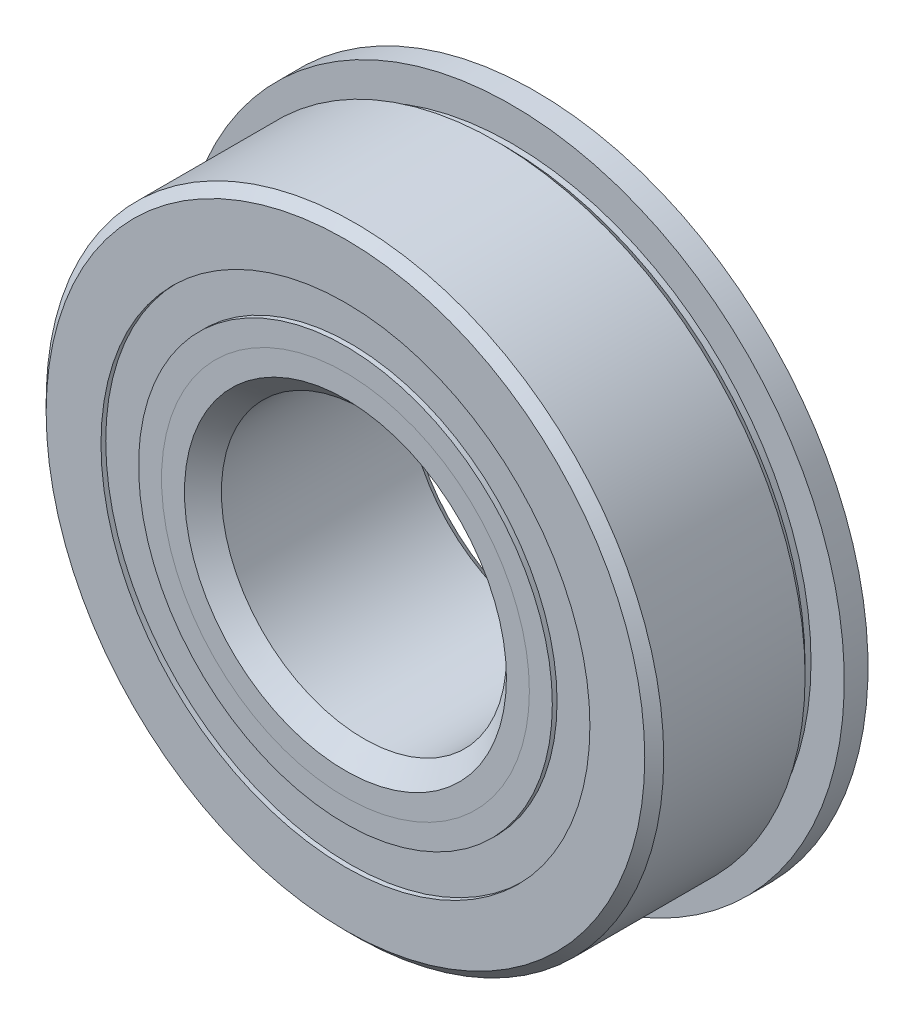
from build123d import *

# Parameters (mm, degrees)
SKETCH5_W         = 1.5875
SKETCH5_H         = 4.055103022
CIRPATTERN1_COUNT = 14
SKETCH7_W         = 2.943392574
SKETCH7_H         = 2.512087912


with BuildPart() as part:
    # Sketch1 → Revolve1 (revolve)
    with BuildSketch(Plane(origin=(0, 0, 0), x_dir=(0, 0, -1), z_dir=(1, 0, 0))):
        with BuildLine():
            Line((5.715, 20.6375), (-5.715, 20.6375))
            Line((-5.715, 20.6375), (-6.35, 20.0025))
            Line((-6.35, 20.0025), (-6.35, 16.337293956))
            Line((-6.35, 16.337293956), (-2.822222222, 16.337293956))
            ThreePointArc((-2.822222222, 16.337293956), (0, 18.170357426), (2.822222222, 16.337293956))
            Line((2.822222222, 16.337293956), (6.35, 16.337293956))
            Line((6.35, 16.337293956), (6.35, 20.0025))
            Line((6.35, 20.0025), (5.715, 20.6375))
        make_face()
    revolve(axis=Axis((0, 0, 6.35), (0, 0, -1)))

    # Sketch5 → Revolve5 (revolve)
    with BuildSketch(Plane(origin=(0, 0, 0), x_dir=(0, 0, -1), z_dir=(1, 0, 0))):
        with Locations((5.55625, 20.197448489)):
            Rectangle(SKETCH5_W, SKETCH5_H)
    revolve(axis=Axis((0, 0, -7.9375), (0, 0, 1)))

    # Sketch6 → Cut-Revolve1 (revolve, cut)
    with BuildSketch(Plane(origin=(0, 0, 0), x_dir=(0, 0, -1), z_dir=(1, 0, 0))):
        Polygon((3.730625, 20.6375), (4.365625, 20.0025), (4.7625, 20.0025), (4.7625, 20.6375), align=None)
    revolve(axis=Axis((0, 0, 6.35), (0, 0, -1)), mode=Mode.SUBTRACT)


with BuildPart() as body_2:
    # Sketch2 → Revolve2 (revolve)
    with BuildSketch(Plane(origin=(0, 0, 0), x_dir=(0, 0, -1), z_dir=(1, 0, 0))):
        with BuildLine():
            Line((-6.35, 13.825206044), (-2.822222222, 13.825206044))
            ThreePointArc((-2.822222222, 13.825206044), (-1.682636321, 12.490628511), (0, 11.992142574))
            Line((0, 11.992142574), (0, 10.758571287))
            Line((0, 10.758571287), (-4.816682621, 10.758571287))
            Line((-4.816682621, 10.758571287), (-6.35, 12.291888665))
            Line((-6.35, 12.291888665), (-6.35, 13.825206044))
        make_face()
    revolve(axis=Axis((0, 0, 6.35), (0, 0, -1)))


with BuildPart() as body_3:
    # Sketch3 → Revolve3 (revolve)
    with BuildSketch(Plane(origin=(0, 0, 0), x_dir=(0, 0, -1), z_dir=(1, 0, 0))):
        with BuildLine():
            Line((-6.35, 12.291888665), (-4.816682621, 10.758571287))
            Line((-4.816682621, 10.758571287), (0, 10.758571287))
            Line((0, 10.758571287), (0, 11.992142574))
            ThreePointArc((0, 11.992142574), (1.682636321, 12.490628511), (2.822222222, 13.825206044))
            Line((2.822222222, 13.825206044), (7.9375, 13.825206044))
            Line((7.9375, 13.825206044), (7.9375, 10.16))
            Line((7.9375, 10.16), (7.3025, 9.525))
            Line((7.3025, 9.525), (-5.116428713, 9.525))
            Line((-5.116428713, 9.525), (-6.35, 10.758571287))
            Line((-6.35, 10.758571287), (-6.35, 12.291888665))
        make_face()
    revolve(axis=Axis((0, 0, 6.35), (0, 0, -1)))


with BuildPart() as body_4:
    # Sketch4 → Revolve4 (revolve)
    with BuildSketch(Plane(origin=(0, 0, 0), x_dir=(0, 0, -1), z_dir=(1, 0, 0))):
        with BuildLine():
            Line((-3.089107426, 15.08125), (3.089107426, 15.08125))
            ThreePointArc((3.089107426, 15.08125), (0, 18.170357426), (-3.089107426, 15.08125))
        make_face()
    revolve(axis=Axis((0, 15.08125, 3.089107426), (0, 0, -1)))


with BuildPart() as cirpattern1_1:
    # CirPattern1: pattern copy
    add(body_4.part.rotate(Axis((0, 0, -6.35), (0, 0, 1)), 1 * 360 / CIRPATTERN1_COUNT))


with BuildPart() as cirpattern1_2:
    # CirPattern1: pattern copy
    add(body_4.part.rotate(Axis((0, 0, -6.35), (0, 0, 1)), 2 * 360 / CIRPATTERN1_COUNT))


with BuildPart() as cirpattern1_3:
    # CirPattern1: pattern copy
    add(body_4.part.rotate(Axis((0, 0, -6.35), (0, 0, 1)), 3 * 360 / CIRPATTERN1_COUNT))


with BuildPart() as cirpattern1_4:
    # CirPattern1: pattern copy
    add(body_4.part.rotate(Axis((0, 0, -6.35), (0, 0, 1)), 4 * 360 / CIRPATTERN1_COUNT))


with BuildPart() as cirpattern1_5:
    # CirPattern1: pattern copy
    add(body_4.part.rotate(Axis((0, 0, -6.35), (0, 0, 1)), 5 * 360 / CIRPATTERN1_COUNT))


with BuildPart() as cirpattern1_6:
    # CirPattern1: pattern copy
    add(body_4.part.rotate(Axis((0, 0, -6.35), (0, 0, 1)), 6 * 360 / CIRPATTERN1_COUNT))


with BuildPart() as cirpattern1_7:
    # CirPattern1: pattern copy
    add(body_4.part.rotate(Axis((0, 0, -6.35), (0, 0, 1)), 7 * 360 / CIRPATTERN1_COUNT))


with BuildPart() as cirpattern1_8:
    # CirPattern1: pattern copy
    add(body_4.part.rotate(Axis((0, 0, -6.35), (0, 0, 1)), 8 * 360 / CIRPATTERN1_COUNT))


with BuildPart() as cirpattern1_9:
    # CirPattern1: pattern copy
    add(body_4.part.rotate(Axis((0, 0, -6.35), (0, 0, 1)), 9 * 360 / CIRPATTERN1_COUNT))


with BuildPart() as cirpattern1_10:
    # CirPattern1: pattern copy
    add(body_4.part.rotate(Axis((0, 0, -6.35), (0, 0, 1)), 10 * 360 / CIRPATTERN1_COUNT))


with BuildPart() as cirpattern1_11:
    # CirPattern1: pattern copy
    add(body_4.part.rotate(Axis((0, 0, -6.35), (0, 0, 1)), 11 * 360 / CIRPATTERN1_COUNT))


with BuildPart() as cirpattern1_12:
    # CirPattern1: pattern copy
    add(body_4.part.rotate(Axis((0, 0, -6.35), (0, 0, 1)), 12 * 360 / CIRPATTERN1_COUNT))


with BuildPart() as cirpattern1_13:
    # CirPattern1: pattern copy
    add(body_4.part.rotate(Axis((0, 0, -6.35), (0, 0, 1)), 13 * 360 / CIRPATTERN1_COUNT))


with BuildPart() as body_18:
    # Sketch7 → Revolve6 (revolve)
    with BuildSketch(Plane(origin=(0, 0, 0), x_dir=(0, 0, -1), z_dir=(1, 0, 0))):
        with Locations((-4.560803713, 15.08125)):
            Rectangle(SKETCH7_W, SKETCH7_H)
        with Locations((4.560803713, 15.08125)):
            Rectangle(SKETCH7_W, SKETCH7_H)
    revolve(axis=Axis((0, 0, 6.35), (0, 0, -1)))


solid = Compound([part.part, body_2.part, body_3.part, body_4.part, cirpattern1_1.part, cirpattern1_2.part, cirpattern1_3.part, cirpattern1_4.part, cirpattern1_5.part, cirpattern1_6.part, cirpattern1_7.part, cirpattern1_8.part, cirpattern1_9.part, cirpattern1_10.part, cirpattern1_11.part, cirpattern1_12.part, cirpattern1_13.part, body_18.part])
